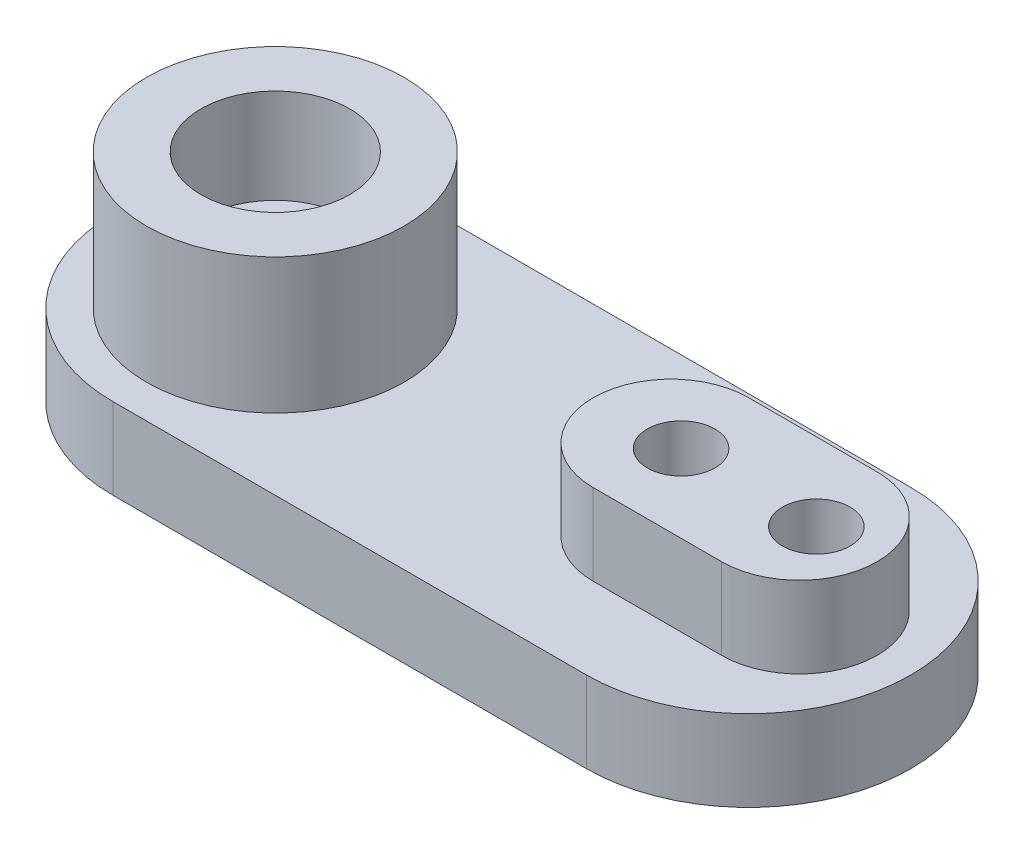
from build123d import *

# Parameters (mm, degrees)
BOSS_EXTRUDE1_DEPTH = 3
SKETCH2_R           = 4.7625
BOSS_EXTRUDE2_DEPTH = 5
BOSS_EXTRUDE3_DEPTH = 3
SKETCH4_R           = 2.75
CUT_EXTRUDE1_DEPTH  = 3.5
SKETCH5_R           = 1.25
CUT_EXTRUDE2_DEPTH  = 25.984995497
SKETCH6_R           = 1.75
CUT_EXTRUDE3_DEPTH  = 25.667792767
SKETCH7_R           = 3
CUT_EXTRUDE4_DEPTH  = 2.5


with BuildPart() as part:
    # Sketch1 → Boss-Extrude1 (new body)
    with BuildSketch(Plane(origin=(0, 0, 0), x_dir=(1, 0, 0), z_dir=(0, 1, 0))):
        with BuildLine():
            Line((0, 6), (17.5, 6))
            ThreePointArc((17.5, 6), (23.5, 0), (17.5, -6))
            Line((17.5, -6), (0, -6))
            ThreePointArc((0, -6), (-6, 0), (0, 6))
        make_face()
    extrude(amount=BOSS_EXTRUDE1_DEPTH)

    # Sketch2 → Boss-Extrude2 (add)
    with BuildSketch(Plane(origin=(0, 3, 0), x_dir=(1, 0, 0), z_dir=(0, 1, 0))):
        with Locations(Location((0, 0, 0), (0, 0, 270))):
            Circle(SKETCH2_R)
    extrude(amount=BOSS_EXTRUDE2_DEPTH)

    # Sketch3 → Boss-Extrude3 (add)
    with BuildSketch(Plane(origin=(0, 3, 0), x_dir=(1, 0, 0), z_dir=(0, 1, 0))):
        with BuildLine():
            Line((19.375, -2.875), (14.625, -2.875))
            ThreePointArc((14.625, -2.875), (11.75, 0), (14.625, 2.875))
            Line((14.625, 2.875), (19.375, 2.875))
            ThreePointArc((19.375, 2.875), (22.25, 0), (19.375, -2.875))
        make_face()
    extrude(amount=BOSS_EXTRUDE3_DEPTH)

    # Sketch4 → Cut-Extrude1 (cut)
    with BuildSketch(Plane(origin=(0, 8, 0), x_dir=(1, 0, 0), z_dir=(0, 1, 0))):
        with Locations(Location((0, 0, 0), (0, 0, 270))):
            Circle(SKETCH4_R)
    extrude(amount=-CUT_EXTRUDE1_DEPTH, mode=Mode.SUBTRACT)

    # Sketch5 → Cut-Extrude2 (cut, through all)
    with BuildSketch(Plane(origin=(0, 6, 0), x_dir=(1, 0, 0), z_dir=(0, 1, 0))):
        with Locations(Location((20, 0, 0), (0, 0, 270))):
            Circle(SKETCH5_R)
        with Locations(Location((15, 0, 0), (0, 0, 270))):
            Circle(SKETCH5_R)
    extrude(amount=-CUT_EXTRUDE2_DEPTH, mode=Mode.SUBTRACT)

    # Sketch6 → Cut-Extrude3 (cut, through all)
    with BuildSketch(Plane(origin=(0, 4.5, 0), x_dir=(1, 0, 0), z_dir=(0, 1, 0))):
        with Locations(Location((0, 0, 0), (0, 0, 270))):
            Circle(SKETCH6_R)
    extrude(amount=-CUT_EXTRUDE3_DEPTH, mode=Mode.SUBTRACT)

    # Sketch7 → Cut-Extrude4 (cut)
    with BuildSketch(Plane.XZ):
        with Locations(Location((0, 0, 0), (0, 0, 270))):
            Circle(SKETCH7_R)
    extrude(amount=-CUT_EXTRUDE4_DEPTH, mode=Mode.SUBTRACT)


solid = part.part
